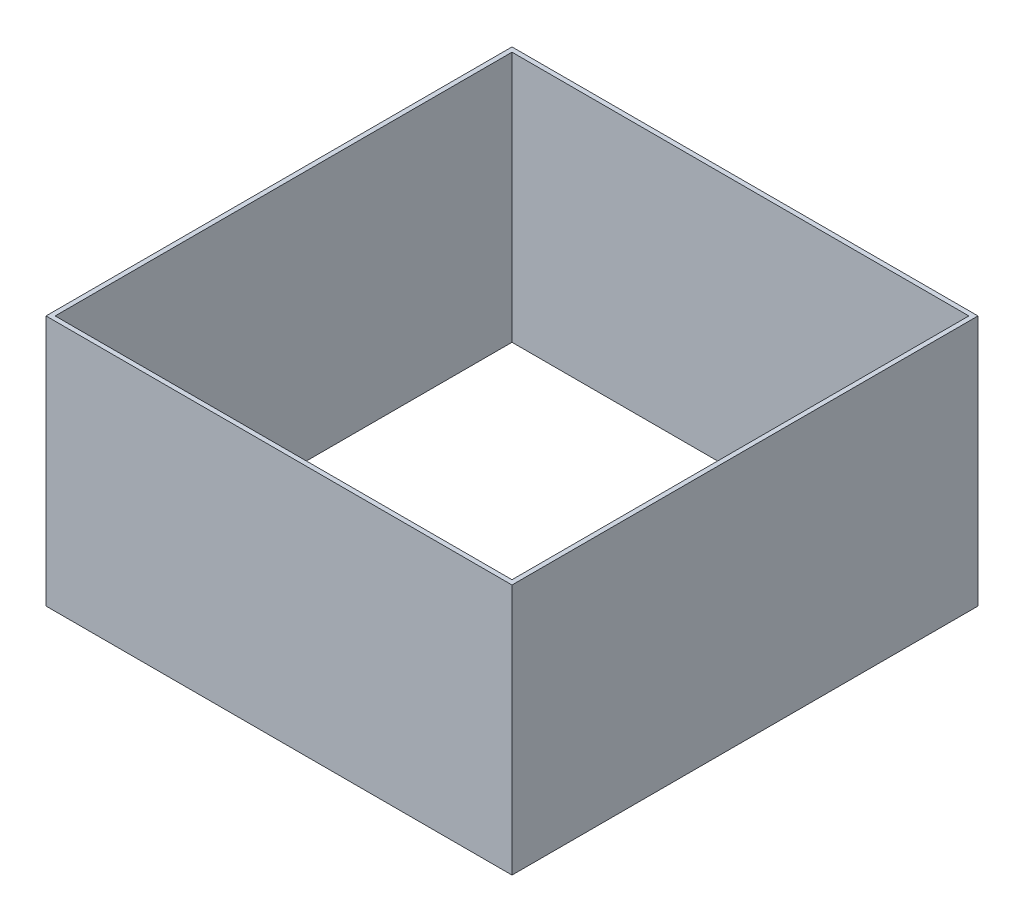
from build123d import *

# Parameters (mm, degrees)
SKETCH1_W           = 102
SKETCH1_H           = 102
SKETCH1_W_2         = 100
SKETCH1_H_2         = 100
BOSS_EXTRUDE1_DEPTH = 55


with BuildPart() as part:
    # Sketch1 → Boss-Extrude1 (new body)
    with BuildSketch(Plane(origin=(0, 0, 0), x_dir=(1, 0, 0), z_dir=(0, 1, 0))):
        with Locations((51, 51)):
            Rectangle(SKETCH1_W, SKETCH1_H)
        with Locations((51, 51)):
            Rectangle(SKETCH1_W_2, SKETCH1_H_2, mode=Mode.SUBTRACT)
    extrude(amount=BOSS_EXTRUDE1_DEPTH)


solid = part.part
